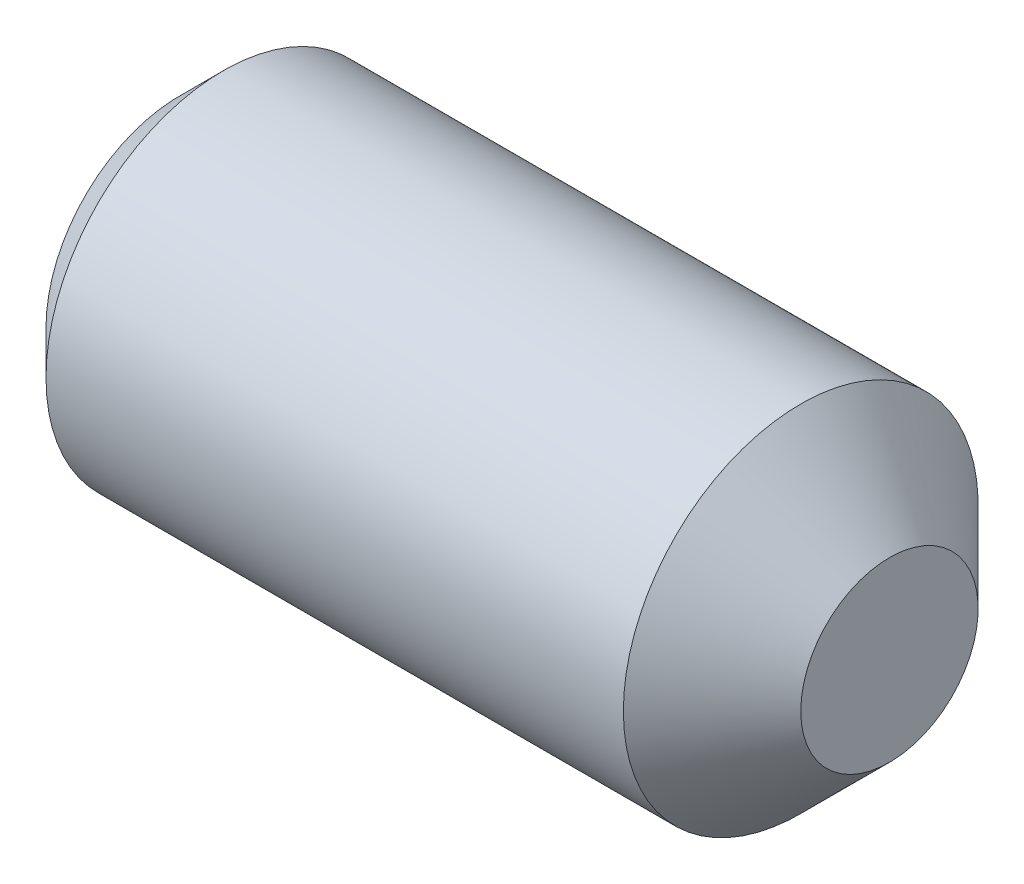
from build123d import *

# Parameters (mm, degrees)
CUT_EXTRUDE1_DEPTH = 0.8


with BuildPart() as part:
    # Sketch1 → Revolve1 (revolve)
    with BuildSketch(Plane.XY, mode=Mode.PRIVATE) as revolve1_sk:
        Polygon((-4, 0), (-4, 0.7545), (-3.7545, 1), (-0.5, 1), (0, 0.5), (0, 0), align=None)
    revolve(revolve1_sk.sketch.rotate(Axis((0, 0, 0), (-1, 0, 0)), 270), axis=Axis((0, 0, 0), (-1, 0, 0)))

    # Sketch2 → Cut-Extrude1 (cut)
    with BuildSketch(Plane.ZY.offset(4)):
        Polygon((-0.259807621, -0.45), (0.259807621, -0.45), (0.519615242, 0), (0.259807621, 0.45), (-0.259807621, 0.45), (-0.519615242, 0), align=None)
    extrude(amount=-CUT_EXTRUDE1_DEPTH, mode=Mode.SUBTRACT)

    # Sketch3 → Cut-Revolve1 (revolve, cut)
    with BuildSketch(Plane.XY, mode=Mode.PRIVATE) as cut_revolve1_sk:
        Polygon((-3.2, 0), (-3.2, 0.45), (-2.940192379, 0), align=None)
    revolve(cut_revolve1_sk.sketch.rotate(Axis((-2.940192379, 0, 0), (-1, 0, 0)), 270), axis=Axis((-2.940192379, 0, 0), (-1, 0, 0)), mode=Mode.SUBTRACT)


solid = part.part
